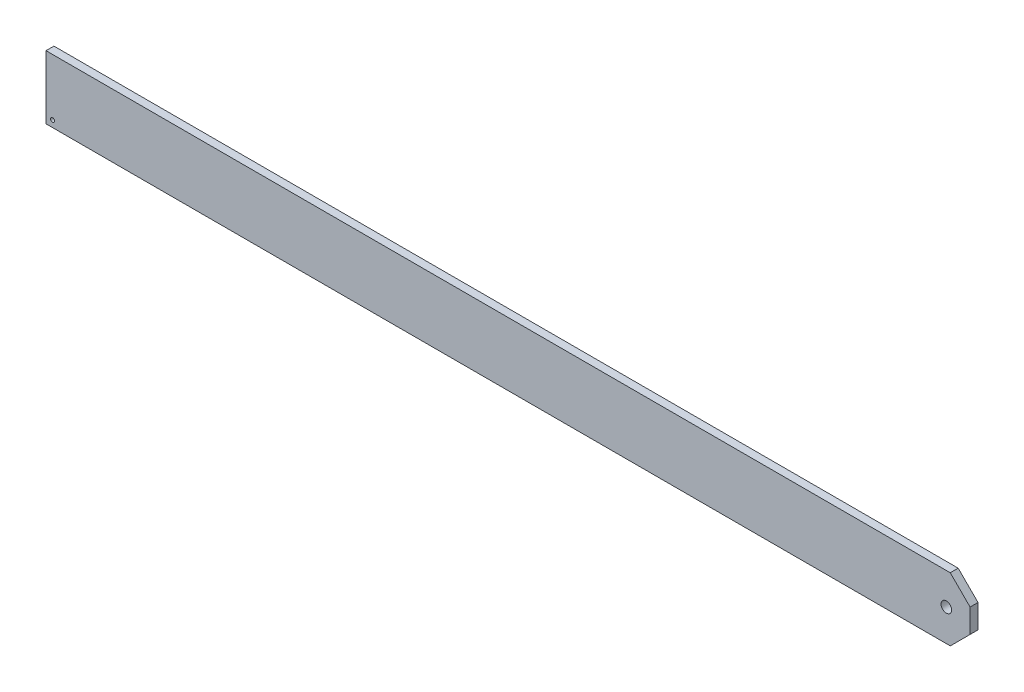
from build123d import *

# Parameters (mm, degrees)
SKETCH1_R           = 4
BOSS_EXTRUDE1_DEPTH = 6
SKETCH2_R           = 1.5
CUT_EXTRUDE1_DEPTH  = 10


with BuildPart() as part:
    # Sketch1 → Boss-Extrude1 (new body)
    with BuildSketch(Plane.XY):
        Polygon((377.584269663, 60.134831461), (392.584269663, 45.134831461), (392.584269663, 27.134831461), (377.584269663, 12.134831461), (-307.415730337, 12.134831461), (-307.415730337, 60.134831461), align=None)
        with Locations((374.584269663, 36.134831461)):
            Circle(SKETCH1_R, mode=Mode.SUBTRACT)
    extrude(amount=BOSS_EXTRUDE1_DEPTH)

    # Sketch2 → Cut-Extrude1 (cut)
    with BuildSketch(Plane.XY.offset(6)):
        with Locations((-302.415730337, 17.134831461)):
            Circle(SKETCH2_R)
    extrude(amount=-CUT_EXTRUDE1_DEPTH, mode=Mode.SUBTRACT)


solid = part.part
